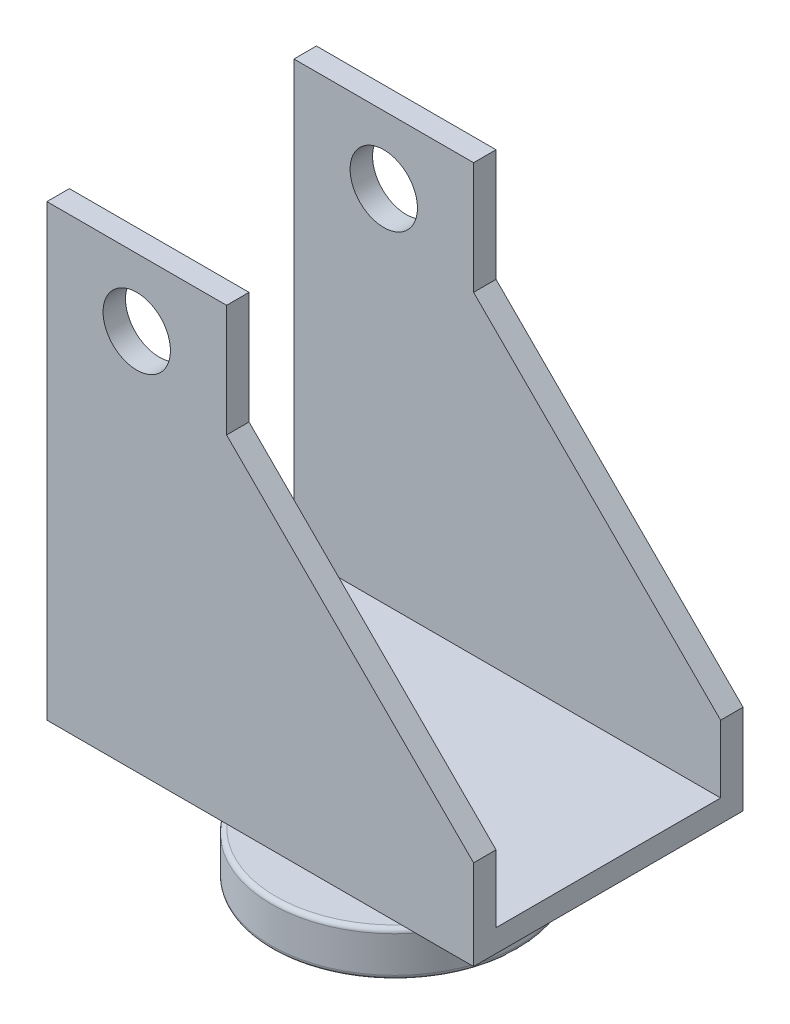
from build123d import *

# Parameters (mm, degrees)
BOSS_EXTRUDE1_DEPTH = 5
BOSS_EXTRUDE2_DEPTH = 5
SKETCH3_R           = 7.5
CUT_EXTRUDE1_DEPTH  = 149.492424049
SKETCH4_R           = 15
BOSS_EXTRUDE3_DEPTH = 12
SKETCH5_R           = 27.5
BOSS_EXTRUDE4_DEPTH = 10
FILLET1_R           = 1


with BuildPart() as part:
    # Sketch1 → Boss-Extrude1 (new body)
    with BuildSketch(Plane(origin=(0, 0, 0), x_dir=(1, 0, 0), z_dir=(0, 1, 0))):
        Polygon((0, 0), (0, 25), (95, 25), (95, -25), (0, -25), align=None)
    extrude(amount=BOSS_EXTRUDE1_DEPTH)

    # Sketch2 → Boss-Extrude2 (add)
    with BuildSketch(Plane.XY.offset(25)):
        Polygon((0, 0), (0, 100), (40, 100), (40, 75), (95, 20), (95, 0), align=None)
    boss_extrude2 = extrude(amount=BOSS_EXTRUDE2_DEPTH)

    # Sketch3 → Cut-Extrude1 (cut, through all)
    with BuildSketch(Plane.XY.offset(30)):
        with Locations((20, 85)):
            Circle(SKETCH3_R)
    cut_extrude1 = extrude(amount=-CUT_EXTRUDE1_DEPTH, mode=Mode.SUBTRACT)

    # Mirror1: Boss-Extrude2, Cut-Extrude1 across plane
    add(boss_extrude2.mirror(Plane.XY))
    add(cut_extrude1.mirror(Plane.XY), mode=Mode.SUBTRACT)

    # Sketch4 → Boss-Extrude3 (add)
    with BuildSketch(Plane(origin=(0, 0, 0), x_dir=(-1, 0, 0), z_dir=(0, -1, 0))):
        with Locations(Location((-47.5, 0, 0), (0, 0, 90))):
            Circle(SKETCH4_R)
    extrude(amount=BOSS_EXTRUDE3_DEPTH)

    # Sketch5 → Boss-Extrude4 (add)
    with BuildSketch(Plane(origin=(0, -12, 0), x_dir=(-1, 0, 0), z_dir=(0, -1, 0))):
        with Locations(Location((-47.5, 0, 0), (0, 0, 90))):
            Circle(SKETCH5_R)
    extrude(amount=BOSS_EXTRUDE4_DEPTH)

    # Fillet1
    fillet1_edges = [part.edges().sort_by_distance(p)[0] for p in [
        (47.5, -12, 27.5),
        (47.5, -22, 27.5),
    ]]
    fillet(fillet1_edges, radius=FILLET1_R)


solid = part.part
